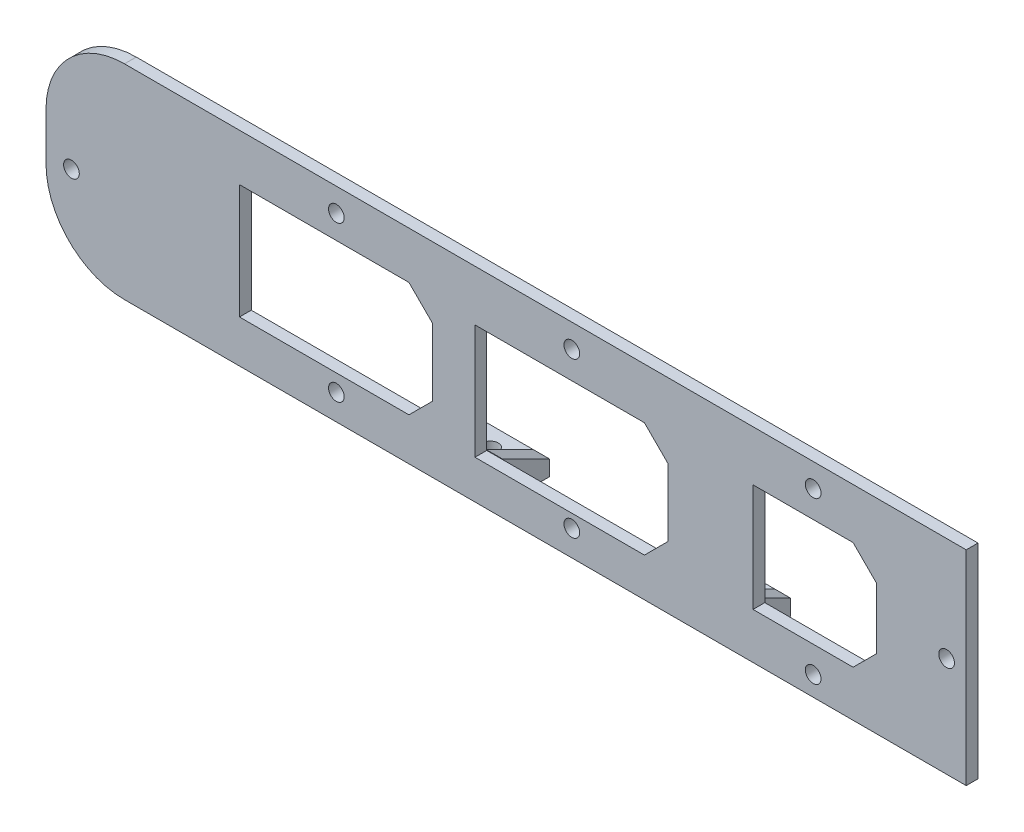
from build123d import *

# Parameters (mm, degrees)
SKETCH1_W            = 229.5
SKETCH1_H            = 49
BOSS_EXTRUDE1_DEPTH  = 3
SKETCH3_W            = 229.5
SKETCH3_H            = 3
BOSS_EXTRUDE2_DEPTH  = 6
SKETCH2_R            = 2
CUT_EXTRUDE1_DEPTH   = 31.956
SKETCH4_R            = 2
CUT_EXTRUDE2_DEPTH   = 31.956
BOSS_EXTRUDE3_DEPTH  = 3
SKETCH10_W           = 229.5
SKETCH10_H           = 2.9625
CUT_EXTRUDE5_DEPTH   = 11.382
BOSS_EXTRUDE4_DEPTH  = 12
SKETCH13_R           = 2
CUT_EXTRUDE7_DEPTH   = 15
BOSS_EXTRUDE5_DEPTH  = 4
BOSS_EXTRUDE6_DEPTH  = 4
BOSS_EXTRUDE7_DEPTH  = 4
BOSS_EXTRUDE8_DEPTH  = 4
SKETCH19_W           = 3
SKETCH19_H           = 52.0375
BOSS_EXTRUDE9_DEPTH  = 2.984
CUT_EXTRUDE8_DEPTH   = 20.764
SKETCH23_W           = 3
SKETCH23_H           = 52.0375
BOSS_EXTRUDE10_DEPTH = 2
SKETCH24_W           = 20
SKETCH24_H           = 3
CUT_EXTRUDE9_DEPTH   = 3


with BuildPart() as part:
    # Sketch1 → Boss-Extrude1 (new body)
    with BuildSketch(Plane.XY):
        Rectangle(SKETCH1_W, SKETCH1_H)
    extrude(amount=BOSS_EXTRUDE1_DEPTH)

    # Sketch3 → Boss-Extrude2 (add)
    with BuildSketch(Plane(origin=(0, 24.5, 0), x_dir=(1, 0, 0), z_dir=(0, 1, 0))):
        with Locations((0, -1.5)):
            Rectangle(SKETCH3_W, SKETCH3_H)
    extrude(amount=BOSS_EXTRUDE2_DEPTH)

    # Sketch2 → Cut-Extrude1 (cut)
    with BuildSketch(Plane.XY.offset(3)):
        with Locations((111.75, 4)):
            Circle(SKETCH2_R)
        with Locations((-111.25, 0.5)):
            Circle(SKETCH2_R)
        with Locations((-43.75, 24.5)):
            Circle(SKETCH2_R)
        with Locations((16.25, 24.5)):
            Circle(SKETCH2_R)
        with Locations((77.75, 24.5)):
            Circle(SKETCH2_R)
    extrude(amount=-CUT_EXTRUDE1_DEPTH, mode=Mode.SUBTRACT)

    # Sketch4 → Cut-Extrude2 (cut)
    with BuildSketch(Plane.XY.offset(3)):
        Polygon((87.924883288, 17.681445753), (62.424883288, 17.681445753), (62.424883288, -9.818554247), (87.924883288, -9.818554247), (93.924883288, -3.818554247), (93.924883288, 11.681445753), align=None)
        Polygon((-19.25, -4.71), (-19.25, 12.5), (-25.25, 18.5), (-68.43, 18.5), (-68.43, -10.71), (-25.25, -10.71), align=None)
        Polygon((-8.429595307, -11.664), (34.750404693, -11.664), (40.750404693, -5.664), (40.750404693, 11.546), (34.750404693, 17.546), (-8.429595307, 17.546), align=None)
        with Locations((-43.75, -15)):
            Circle(SKETCH4_R)
        with Locations((16.25, -15)):
            Circle(SKETCH4_R)
        with Locations((77.75, -16.5)):
            Circle(SKETCH4_R)
    extrude(amount=-CUT_EXTRUDE2_DEPTH, mode=Mode.SUBTRACT)

    # Sketch5 → Boss-Extrude3 (add)
    with BuildSketch(Plane.XY.offset(3)):
        with BuildLine():
            ThreePointArc((-114.75, 5.373397172), (-117.25, 0.5), (-114.75, -4.373397172))
            Line((-114.75, -4.373397172), (-114.75, 5.373397172))
        make_face()
    extrude(amount=-BOSS_EXTRUDE3_DEPTH)

    # Sketch10 → Cut-Extrude5 (cut)
    with BuildSketch(Plane(origin=(0, 0, 0), x_dir=(-1, 0, 0), z_dir=(0, 0, -1))):
        with Locations((0, -23.01875)):
            Rectangle(SKETCH10_W, SKETCH10_H)
    extrude(amount=-CUT_EXTRUDE5_DEPTH, mode=Mode.SUBTRACT)

    # Sketch12 → Boss-Extrude4 (add)
    with BuildSketch(Plane(origin=(0, 0, 0), x_dir=(-1, 0, 0), z_dir=(0, 0, -1))):
        Polygon((-47, -21.5375), (-41, -21.5375), (-41, -17.5375), (-53, -17.5375), (-53, -21.5375), align=None)
        Polygon((8.5, -21.5375), (13.75, -21.5375), (20.5, -21.5375), (20.5, -17.5375), (8.5, -17.5375), align=None)
    extrude(amount=BOSS_EXTRUDE4_DEPTH)

    # Sketch13 → Cut-Extrude7 (cut)
    with BuildSketch(Plane(origin=(0, -17.5375, 0), x_dir=(1, 0, 0), z_dir=(0, 1, 0))):
        with Locations(Location((-14.5, 7, 0), (0, 0, 270))):
            Circle(SKETCH13_R)
        with Locations(Location((47, 7, 0), (0, 0, 270))):
            Circle(SKETCH13_R)
    extrude(amount=-CUT_EXTRUDE7_DEPTH, mode=Mode.SUBTRACT)

    # Sketch14 → Boss-Extrude5 (add)
    with BuildSketch(Plane(origin=(53, 0, 0), x_dir=(0, 0, -1), z_dir=(1, 0, 0))):
        Polygon((0, -17.5375), (0, -11.5375), (12, -17.5375), (12, -21.5375), (0, -21.5375), align=None)
    extrude(amount=BOSS_EXTRUDE5_DEPTH)

    # Sketch15 → Boss-Extrude6 (add)
    with BuildSketch(Plane.ZY.offset(-41)):
        Polygon((0, -17.5375), (0, -11.5375), (-12, -17.5375), (-12, -21.5375), (0, -21.5375), align=None)
    extrude(amount=BOSS_EXTRUDE6_DEPTH)

    # Sketch16 → Boss-Extrude7 (add)
    with BuildSketch(Plane(origin=(-8.5, 0, 0), x_dir=(0, 0, -1), z_dir=(1, 0, 0))):
        Polygon((0, -17.5375), (0, -11.5375), (12, -17.5375), (12, -21.5375), (0, -21.5375), align=None)
    extrude(amount=BOSS_EXTRUDE7_DEPTH)

    # Sketch17 → Boss-Extrude8 (add)
    with BuildSketch(Plane.ZY.offset(20.5)):
        Polygon((0, -17.5375), (0, -11.5375), (-12, -17.5375), (-12, -21.5375), (0, -21.5375), align=None)
    extrude(amount=BOSS_EXTRUDE8_DEPTH)

    # Sketch19 → Boss-Extrude9 (add)
    with BuildSketch(Plane.ZY.offset(114.75)):
        with Locations((1.5, 4.48125)):
            Rectangle(SKETCH19_W, SKETCH19_H)
    extrude(amount=BOSS_EXTRUDE9_DEPTH)

    # Sketch20 → Cut-Extrude8 (cut)
    with BuildSketch(Plane.XY.offset(3)):
        with BuildLine():
            ThreePointArc((-117.734, 10.5), (-111.876135624, 24.642135624), (-97.734, 30.5))
            Line((-97.734, 30.5), (-117.734, 30.5))
            Line((-117.734, 30.5), (-117.734, 10.5))
        make_face()
        with BuildLine():
            ThreePointArc((-97.734, -21.5375), (-111.876135624, -15.679635624), (-117.734, -1.5375))
            Line((-117.734, -1.5375), (-117.734, -21.5375))
            Line((-117.734, -21.5375), (-97.734, -21.5375))
        make_face()
    extrude(amount=-CUT_EXTRUDE8_DEPTH, mode=Mode.SUBTRACT)

    # Sketch23 → Boss-Extrude10 (add)
    with BuildSketch(Plane(origin=(114.75, 0, 0), x_dir=(0, 0, -1), z_dir=(1, 0, 0))):
        with Locations((-1.5, 4.48125)):
            Rectangle(SKETCH23_W, SKETCH23_H)
    extrude(amount=BOSS_EXTRUDE10_DEPTH)

    # Sketch24 → Cut-Extrude9 (cut)
    with BuildSketch(Plane.XZ.offset(21.5375)):
        with Locations((-14.5, -1.5)):
            Rectangle(SKETCH24_W, SKETCH24_H)
        with Locations((47, -1.5)):
            Rectangle(SKETCH24_W, SKETCH24_H)
    extrude(amount=-CUT_EXTRUDE9_DEPTH, mode=Mode.SUBTRACT)


solid = part.part
